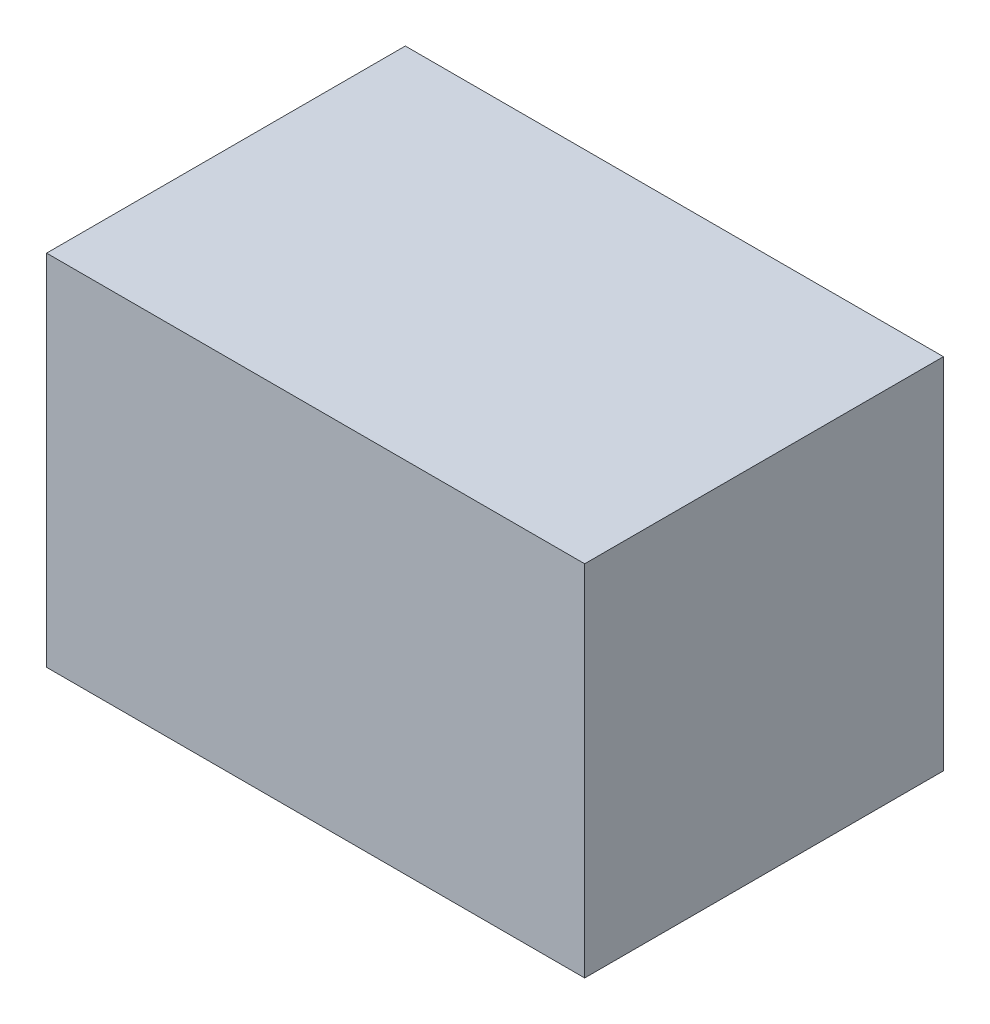
from build123d import *

# Parameters (mm, degrees)
SKETCH1_W           = 2743.2
SKETCH1_H           = 1828.8
BOSS_EXTRUDE1_DEPTH = 1828.8


with BuildPart() as part:
    # Sketch1 → Boss-Extrude1 (new body)
    with BuildSketch(Plane(origin=(0, 0, 0), x_dir=(1, 0, 0), z_dir=(0, 1, 0))):
        with Locations((516.193548387, -132.735483871)):
            Rectangle(SKETCH1_W, SKETCH1_H)
    extrude(amount=BOSS_EXTRUDE1_DEPTH)


solid = part.part
